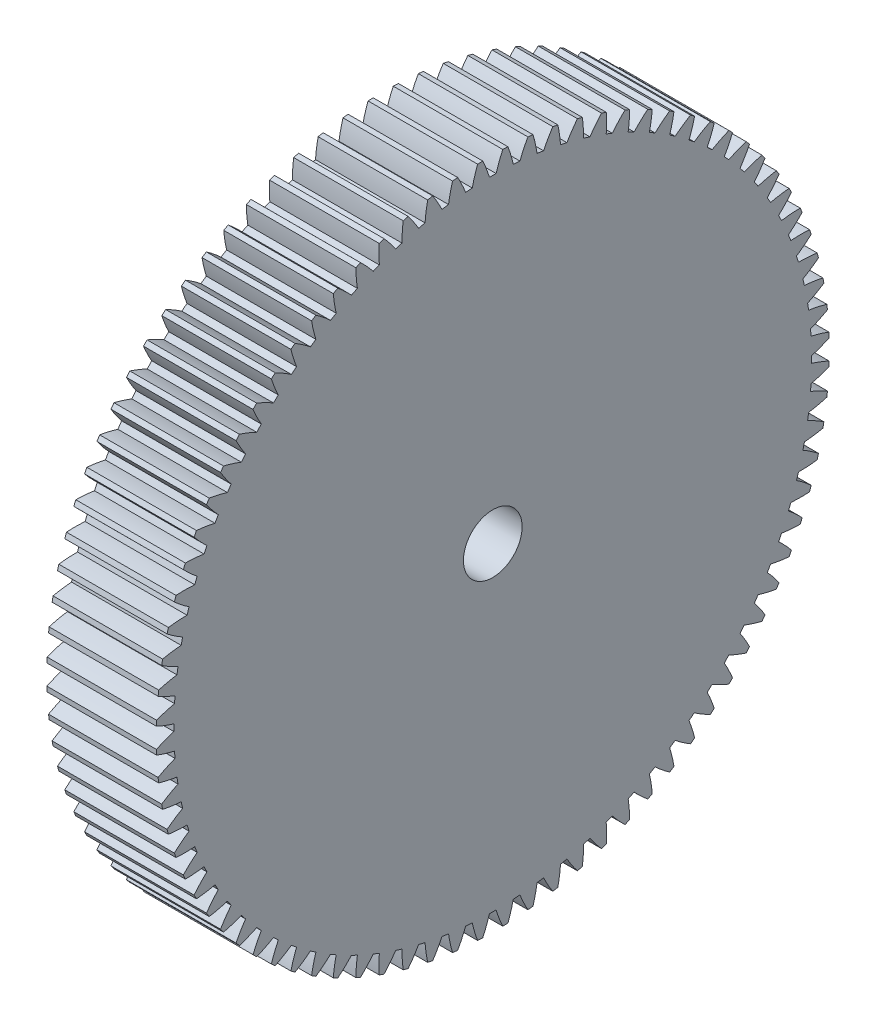
from build123d import *

# Parameters (mm, degrees)
BASPROSKE_W     = 59.266666667
BASPROSKE_H     = 182.033333333
TOOTHCUT_DEPTH  = 265.1681409
TEETHCUTS_COUNT = 84
TEETHCUTS_ANGLE = 355.714285714
BORSKE_R        = 15.875
BORE_DEPTH      = 59.266869867


with BuildPart() as part:
    # BasProSke → Base-Revolve (revolve)
    with BuildSketch(Plane(origin=(0, 0, 0), x_dir=(1, 0, 0), z_dir=(0, 1, 0)), mode=Mode.PRIVATE) as base_revolve_sk:
        with Locations((29.633333334, 91.016666667)):
            Rectangle(BASPROSKE_W, BASPROSKE_H)
    revolve(base_revolve_sk.sketch.rotate(Axis((-10, 0, 0), (1, 0, 0)), 180), axis=Axis((-10, 0, 0), (1, 0, 0)))

    # TooCutSke → ToothCut (cut, through all)
    with BuildSketch(Plane(origin=(0, 0, 0), x_dir=(0, 0, -1), z_dir=(1, 0, 0))):
        with BuildLine():
            ThreePointArc((1.791178308, 172.497763986), (0, 172.507063333), (-1.791178308, 172.497763986))
            ThreePointArc((-1.791178308, 172.497763986), (-3.443698375, 177.302803074), (-5.435083953, 181.977587206))
            ThreePointArc((-5.435083953, 181.977587206), (0, 182.058733333), (5.435083953, 181.977587206))
            ThreePointArc((5.435083953, 181.977587206), (3.443698375, 177.302803074), (1.791178308, 172.497763986))
        make_face()
    toothcut = extrude(amount=TOOTHCUT_DEPTH, mode=Mode.SUBTRACT)

    # TeethCuts: ToothCut ×84 about axis
    teethcuts_axis = Axis((-10, 0, 0), (1, 0, 0))
    for i in range(1, TEETHCUTS_COUNT):
        add(toothcut.rotate(teethcuts_axis, i * TEETHCUTS_ANGLE / (TEETHCUTS_COUNT - 1)), mode=Mode.SUBTRACT)

    # BorSke → Bore (cut, symmetric)
    with BuildSketch(Plane(origin=(0, 0, 0), x_dir=(0, 0, -1), z_dir=(1, 0, 0))):
        with Locations(Location((0, 0, 0), (0, 0, 180))):
            Circle(BORSKE_R)
    extrude(amount=BORE_DEPTH, both=True, mode=Mode.SUBTRACT)


solid = part.part
